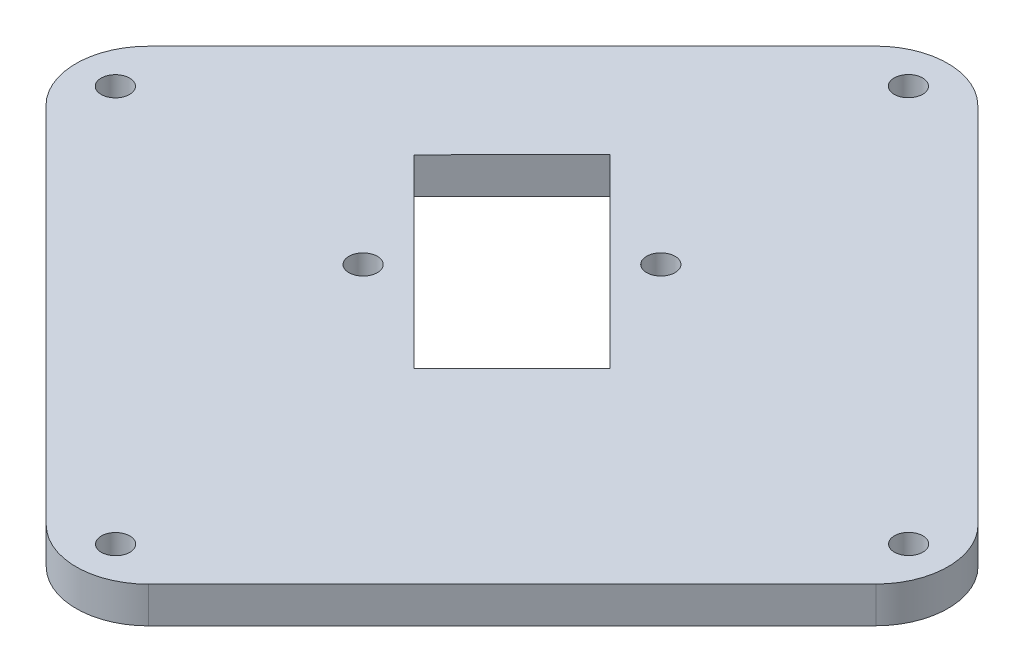
from build123d import *

# Parameters (mm, degrees)
SKETCH1_R           = 1.25
BOSS_EXTRUDE1_DEPTH = 3.175
FILLET1_R           = 6.35


with BuildPart() as part:
    # Sketch1 → Boss-Extrude1 (new body)
    with BuildSketch(Plane(origin=(0, 0, 0), x_dir=(1, 0, 0), z_dir=(0, 1, 0))):
        Polygon((15.147658291, 44.238817403), (-25.76324473, 3.302114568), (15.173458104, -37.608788453), (56.084361126, 3.327914382), align=None)
        with Locations(Location((17.840116094, 13.708278644, 0), (0, 0, 270))):
            Circle(SKETCH1_R, mode=Mode.SUBTRACT)
        with Locations(Location((4.768985382, 0.628904831, 0), (0, 0, 270))):
            Circle(SKETCH1_R, mode=Mode.SUBTRACT)
        with Locations(Location((-19.669398793, 3.304035457, 0), (0, 0, 270))):
            Circle(SKETCH1_R, mode=Mode.SUBTRACT)
        with Locations(Location((15.149579179, 38.144971466, 0), (0, 0, 270))):
            Circle(SKETCH1_R, mode=Mode.SUBTRACT)
        with Locations(Location((49.990509247, 3.325999432, 0), (0, 0, 270))):
            Circle(SKETCH1_R, mode=Mode.SUBTRACT)
        with Locations(Location((15.171537216, -31.514942515, 0), (0, 0, 270))):
            Circle(SKETCH1_R, mode=Mode.SUBTRACT)
        Polygon((14.901563134, -5.042362692), (-1.352871962, 11.201828262), (7.263335329, 19.823469227), (23.517770424, 3.579278273), align=None, mode=Mode.SUBTRACT)
    extrude(amount=BOSS_EXTRUDE1_DEPTH)

    # Fillet1
    fillet1_edges = [part.edges().sort_by_distance(p)[0] for p in [
        (-25.76324473, 1.5875, -3.302114568),
        (15.147658291, 1.5875, -44.238817403),
        (56.084361126, 1.5875, -3.327914382),
        (15.173458104, 1.5875, 37.608788453),
    ]]
    fillet(fillet1_edges, radius=FILLET1_R)


solid = part.part
